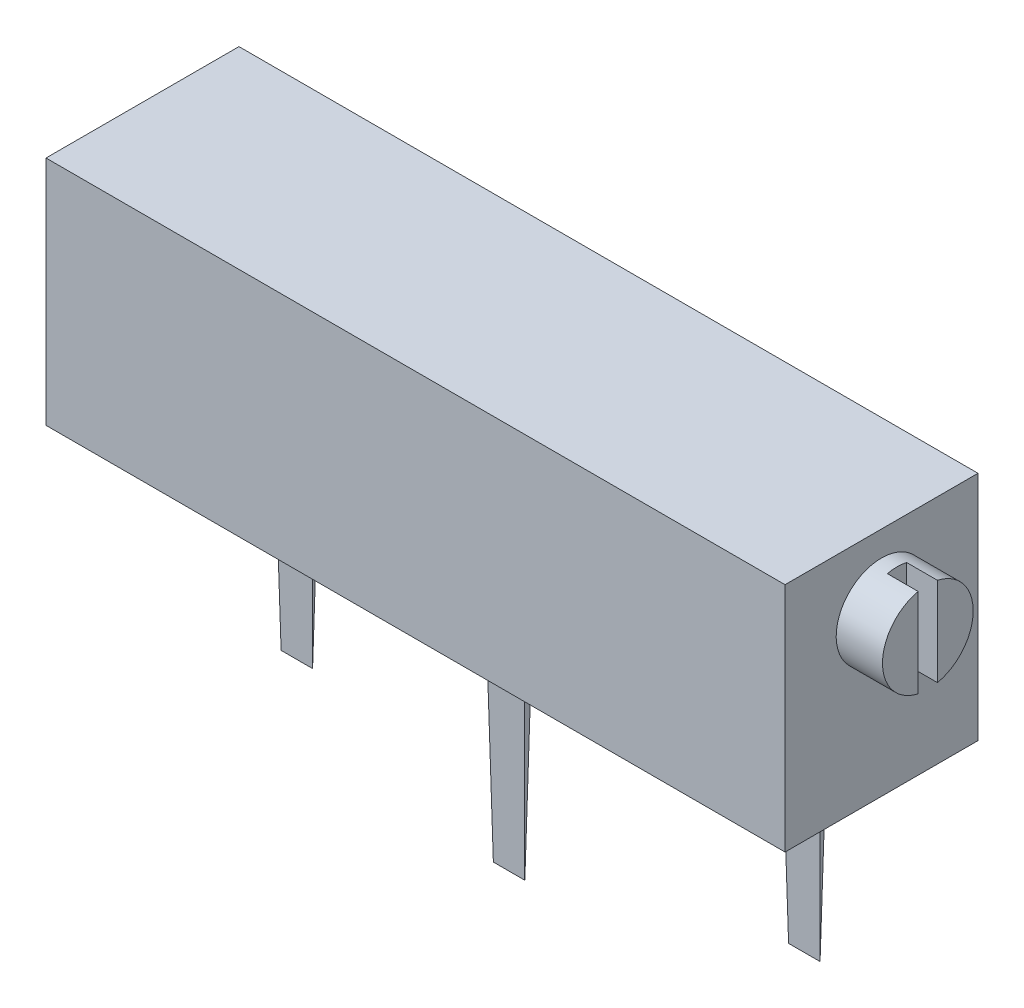
from build123d import *

# Parameters (mm, degrees)
SKETCH1_W                     = 19.15
SKETCH1_H                     = 5
BOSS_EXTRUDE1_DEPTH           = 6
SKETCH3_R                     = 1.175
BOSS_EXTRUDE2_DEPTH           = 1.2
SKETCH4_W                     = 0.5
SKETCH4_H                     = 2.35
CUT_EXTRUDE1_DEPTH            = 0.8
SKETCH5_W                     = 1
SKETCH5_H                     = 0.2
BOSS_EXTRUDE3_DEPTH           = 5.5
BOSS_EXTRUDE3_DRAFT           = 1
BOSS_EXTRUDE3_PROFILE_2_DEPTH = 5.5
BOSS_EXTRUDE3_PROFILE_2_DRAFT = 1
BOSS_EXTRUDE3_PROFILE_3_DEPTH = 5.5
BOSS_EXTRUDE3_PROFILE_3_DRAFT = 1


with BuildPart() as part:
    # Sketch1 → Boss-Extrude1 (new body)
    with BuildSketch(Plane(origin=(0, 0, 0), x_dir=(1, 0, 0), z_dir=(0, 1, 0))):
        with Locations((9.575, 2.5)):
            Rectangle(SKETCH1_W, SKETCH1_H)
    extrude(amount=BOSS_EXTRUDE1_DEPTH)


with BuildPart() as body_2:
    # Sketch3 → Boss-Extrude2 (new body)
    with BuildSketch(Plane(origin=(19.15, 0, 0), x_dir=(0, 0, -1), z_dir=(1, 0, 0))):
        with Locations((2.5, 4.175)):
            Circle(SKETCH3_R)
    extrude(amount=BOSS_EXTRUDE2_DEPTH)

    # Sketch4 → Cut-Extrude1 (cut)
    with BuildSketch(Plane(origin=(20.35, 0, 0), x_dir=(0, 0, -1), z_dir=(1, 0, 0))):
        with Locations((2.5, 4.175)):
            Rectangle(SKETCH4_W, SKETCH4_H)
    extrude(amount=-CUT_EXTRUDE1_DEPTH, mode=Mode.SUBTRACT)


with BuildPart() as body_3:
    # Sketch5 → Boss-Extrude3 (with draft: the straight prism first)
    with BuildSketch(Plane.XZ):
        with Locations((3, -3.5)):
            Rectangle(SKETCH5_W, SKETCH5_H)
    extrude(amount=BOSS_EXTRUDE3_DEPTH)
    # Boss-Extrude3: the draft: its side faces are tilted about the plane it starts from
    boss_extrude3_sides = [body_3.faces().sort_by_distance(p)[0] for p in [
        (3, -2.75, -3.6),
        (3.5, -2.75, -3.5),
        (3, -2.75, -3.4),
        (2.5, -2.75, -3.5),
    ]]
    draft(boss_extrude3_sides, Plane.XZ, BOSS_EXTRUDE3_DRAFT)


with BuildPart() as body_4:
    # Sketch5 → Boss-Extrude3 profile 2 (with draft: the straight prism first)
    with BuildSketch(Plane.XZ):
        with Locations((10.5, -1.5)):
            Rectangle(SKETCH5_W, SKETCH5_H)
    extrude(amount=BOSS_EXTRUDE3_PROFILE_2_DEPTH)
    # Boss-Extrude3 profile 2: the draft: its side faces are tilted about the plane it starts from
    boss_extrude3_profile_2_sides = [body_4.faces().sort_by_distance(p)[0] for p in [
        (10.5, -2.75, -1.6),
        (11, -2.75, -1.5),
        (10.5, -2.75, -1.4),
        (10, -2.75, -1.5),
    ]]
    draft(boss_extrude3_profile_2_sides, Plane.XZ, BOSS_EXTRUDE3_PROFILE_2_DRAFT)


with BuildPart() as body_5:
    # Sketch5 → Boss-Extrude3 profile 3 (with draft: the straight prism first)
    with BuildSketch(Plane.XZ):
        with Locations((16.15, -3.5)):
            Rectangle(SKETCH5_W, SKETCH5_H)
    extrude(amount=BOSS_EXTRUDE3_PROFILE_3_DEPTH)
    # Boss-Extrude3 profile 3: the draft: its side faces are tilted about the plane it starts from
    boss_extrude3_profile_3_sides = [body_5.faces().sort_by_distance(p)[0] for p in [
        (16.15, -2.75, -3.6),
        (16.65, -2.75, -3.5),
        (16.15, -2.75, -3.4),
        (15.65, -2.75, -3.5),
    ]]
    draft(boss_extrude3_profile_3_sides, Plane.XZ, BOSS_EXTRUDE3_PROFILE_3_DRAFT)


solid = Compound([part.part, body_2.part, body_3.part, body_4.part, body_5.part])
